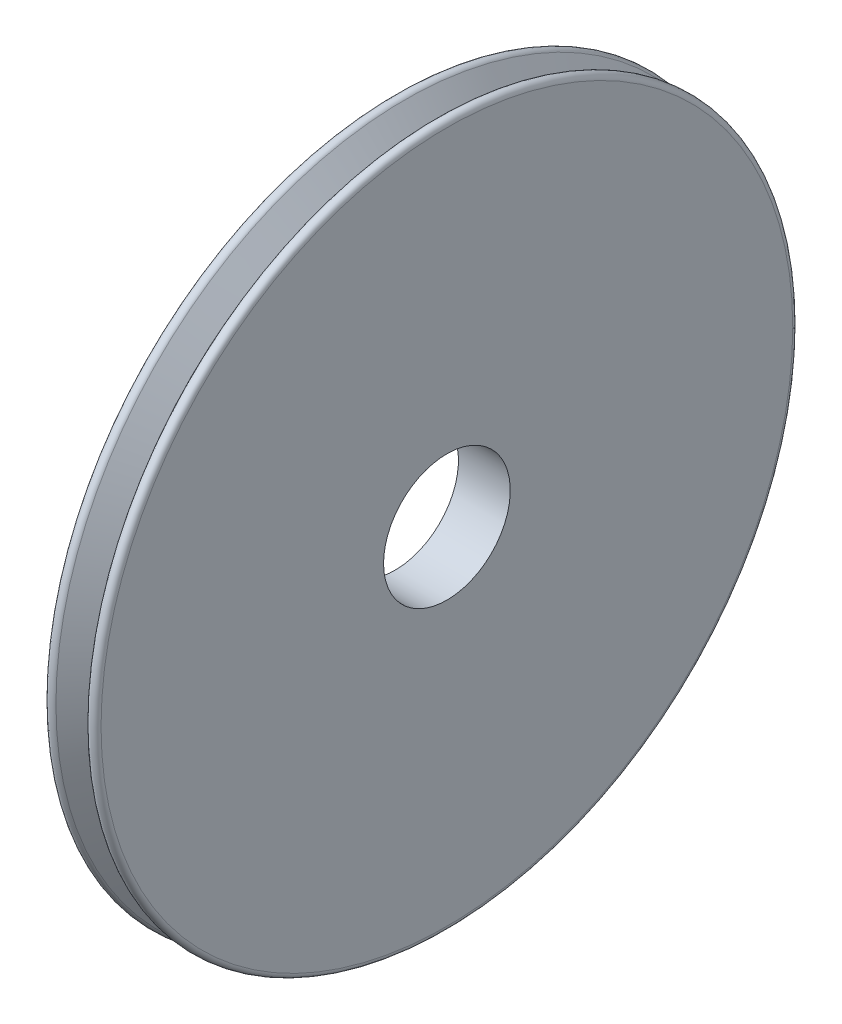
from build123d import *

# Parameters (mm, degrees)
FILLET1_R          = 0.75
SKETCH2_R          = 8.73
CUT_EXTRUDE1_DEPTH = 5


with BuildPart() as part:
    # Sketch1 → Revolve1 (revolve)
    with BuildSketch(Plane.XY, mode=Mode.PRIVATE) as revolve1_sk:
        Polygon((-3.57, 50), (-3.57, 0), (0, 0), (0, 45), align=None)
        Polygon((0, 45), (0, 0), (3.57, 0), (3.57, 50), align=None)
    revolve(revolve1_sk.sketch.rotate(Axis((0, 0, 0), (1, 0, 0)), 90), axis=Axis((0, 0, 0), (1, 0, 0)))

    # Fillet1
    fillet1_edges = [part.edges().sort_by_distance(p)[0] for p in [
        (-3.57, 0, -50),
        (3.57, 0, -50),
    ]]
    fillet(fillet1_edges, radius=FILLET1_R)

    # Sketch2 → Cut-Extrude1 (cut, symmetric)
    with BuildSketch(Plane(origin=(0, 0, 0), x_dir=(0, 0, -1), z_dir=(1, 0, 0))):
        with Locations(Location((0, 0, 0), (0, 0, 180))):
            Circle(SKETCH2_R)
    extrude(amount=CUT_EXTRUDE1_DEPTH, both=True, mode=Mode.SUBTRACT)


solid = part.part
